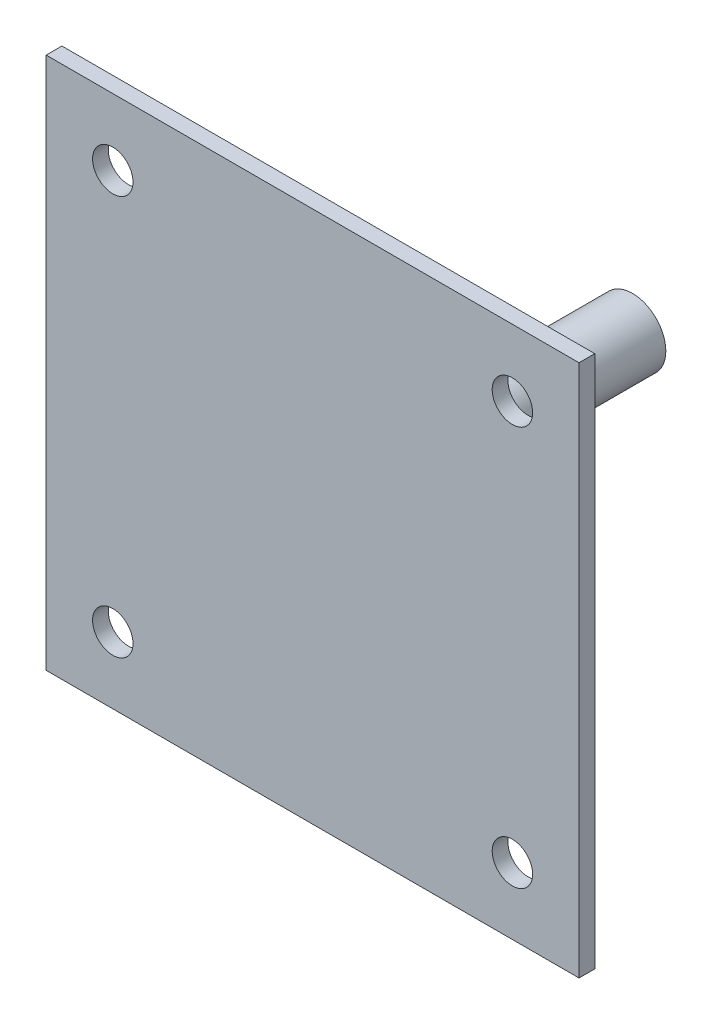
from build123d import *

# Parameters (mm, degrees)
SKETCH1_W           = 101.6
SKETCH1_H           = 101.6
SKETCH1_R           = 3.856433765
BOSS_EXTRUDE1_DEPTH = 3
SKETCH1_4_R         = 6.35
BOSS_EXTRUDE2_DEPTH = 58


with BuildPart() as part:
    # Sketch1 → Boss-Extrude1 (new body)
    with BuildSketch(Plane.XY):
        Rectangle(SKETCH1_W, SKETCH1_H)
        with Locations((-38.1, -38.1)):
            Circle(SKETCH1_R, mode=Mode.SUBTRACT)
        with Locations((38.1, -38.1)):
            Circle(SKETCH1_R, mode=Mode.SUBTRACT)
        with Locations((-38.1, 38.1)):
            Circle(SKETCH1_R, mode=Mode.SUBTRACT)
        with Locations((38.1, 38.1)):
            Circle(SKETCH1_R, mode=Mode.SUBTRACT)
    extrude(amount=BOSS_EXTRUDE1_DEPTH)

    # Sketch1<4> → Boss-Extrude2 (add)
    with BuildSketch(Plane.XY):
        Circle(SKETCH1_4_R)
    extrude(amount=-BOSS_EXTRUDE2_DEPTH)


solid = part.part
